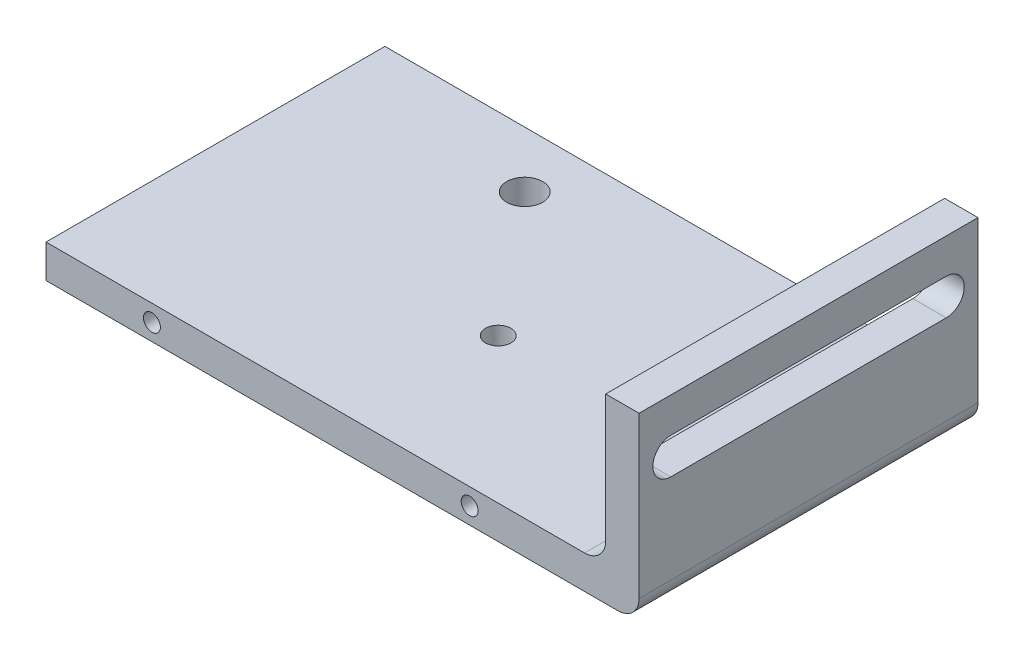
from build123d import *

# Parameters (mm, degrees)
SKETCH_1_W                       = 71
SKETCH_1_H                       = 32
EXTRUDE_1_DEPTH                  = 3.15
SKETCH_2_W                       = 3.15
SKETCH_2_H                       = 32
EXTRUDE_2_DEPTH                  = 14
FILLET_1_R                       = 2
SKETCH_3_R                       = 1.7
SKETCH_3_R_2                     = 1.2
CUT_EXTRUDE_1_DEPTH              = 43.548472358
CUT_EXTRUDE_2_DEPTH              = 75.773808917
SKETCH_7_W                       = 32
SKETCH_7_H                       = 3.15
CUT_EXTRUDE_3_DEPTH              = 15
HOLE_WIZARD_M2_2_D               = 1.6
HOLE_WIZARD_M2_2_DEPTH           = 4
HOLE_WIZARD_M2_2_TIP             = 0.480688495
HOLE_WIZARD_M2_2_ON_FACE_2_D     = 1.6
HOLE_WIZARD_M2_2_ON_FACE_2_DEPTH = 4
HOLE_WIZARD_M2_2_ON_FACE_2_TIP   = 0.480688495


with BuildPart() as part:
    # 草图1 → 凸台-拉伸1 (new body)
    with BuildSketch(Plane(origin=(0, 0, 0), x_dir=(1, 0, 0), z_dir=(0, 1, 0))):
        Rectangle(SKETCH_1_W, SKETCH_1_H)
    extrude(amount=EXTRUDE_1_DEPTH)

    # 草图2 → 凸台-拉伸2 (add)
    with BuildSketch(Plane(origin=(0, 3.15, 0), x_dir=(1, 0, 0), z_dir=(0, 1, 0))):
        with Locations((33.925, 0)):
            Rectangle(SKETCH_2_W, SKETCH_2_H)
    extrude(amount=EXTRUDE_2_DEPTH)

    # 圆角1
    fillet_1_edges = [part.edges().sort_by_distance(p)[0] for p in [
        (32.35, 3.15, 0),
        (35.5, 0, 0),
    ]]
    fillet(fillet_1_edges, radius=FILLET_1_R)

    # 草图3 → 切除-拉伸1 (cut, through all)
    with BuildSketch(Plane.XZ):
        with Locations(Location((-2, -10.7, 0), (0, 0, 270))):
            Circle(SKETCH_3_R)
        with Locations(Location((8.5, 2.3, 0), (0, 0, 270))):
            Circle(SKETCH_3_R_2)
    extrude(amount=-CUT_EXTRUDE_1_DEPTH, mode=Mode.SUBTRACT)

    # 草图5 → M2x0.4 螺纹孔1 (revolve, cut)
    with BuildSketch(Plane(origin=(19.5, 1.575, 16), x_dir=(0, -1, 0), z_dir=(1, 0, 0))):
        Polygon((0, 0), (0, 5.680688495), (0.8, 5.2), (0.8, 0), align=None)
    m2x0_4_1 = revolve(axis=Axis((19.5, 1.575, 22.35), (0, 0, -1)), mode=Mode.SUBTRACT)

    # 镜向1: M2x0.4 螺纹孔1 across plane
    add(m2x0_4_1.mirror(Plane.XY), mode=Mode.SUBTRACT)

    # 草图6 → 切除-拉伸2 (cut, through all)
    with BuildSketch(Plane(origin=(35.5, 0, 0), x_dir=(0, 0, -1), z_dir=(1, 0, 0))):
        with BuildLine():
            Line((-13, 13.85), (13, 13.85))
            ThreePointArc((13, 13.85), (14.7, 12.15), (13, 10.45))
            Line((13, 10.45), (-13, 10.45))
            ThreePointArc((-13, 10.45), (-14.7, 12.15), (-13, 13.85))
        make_face()
    extrude(amount=-CUT_EXTRUDE_2_DEPTH, mode=Mode.SUBTRACT)

    # 草图7 → 切除-拉伸3 (cut)
    with BuildSketch(Plane.ZY.offset(35.5)):
        with Locations((0, 1.575)):
            Rectangle(SKETCH_7_W, SKETCH_7_H)
    extrude(amount=-CUT_EXTRUDE_3_DEPTH, mode=Mode.SUBTRACT)

    # M2 螺纹孔2
    with Locations(Plane(origin=(-10.5, 1.575, 16), x_dir=(1, 0, 0), z_dir=(0, 0, 1))):
        with Locations((0, 0)):
            Hole(HOLE_WIZARD_M2_2_D / 2, depth=HOLE_WIZARD_M2_2_DEPTH)
            with Locations((0, 0, -(HOLE_WIZARD_M2_2_DEPTH + HOLE_WIZARD_M2_2_TIP / 2))):  # 118° drill point
                Cone(0, HOLE_WIZARD_M2_2_D / 2, HOLE_WIZARD_M2_2_TIP, mode=Mode.SUBTRACT)

    # M2 螺纹孔2 on face 2
    with Locations(Plane(origin=(-10.5, 1.575, -16), x_dir=(-1, 0, 0), z_dir=(0, 0, -1))):
        with Locations((0, 0)):
            Hole(HOLE_WIZARD_M2_2_ON_FACE_2_D / 2, depth=HOLE_WIZARD_M2_2_ON_FACE_2_DEPTH)
            with Locations((0, 0, -(HOLE_WIZARD_M2_2_ON_FACE_2_DEPTH + HOLE_WIZARD_M2_2_ON_FACE_2_TIP / 2))):  # 118° drill point
                Cone(0, HOLE_WIZARD_M2_2_ON_FACE_2_D / 2, HOLE_WIZARD_M2_2_ON_FACE_2_TIP, mode=Mode.SUBTRACT)


solid = part.part
